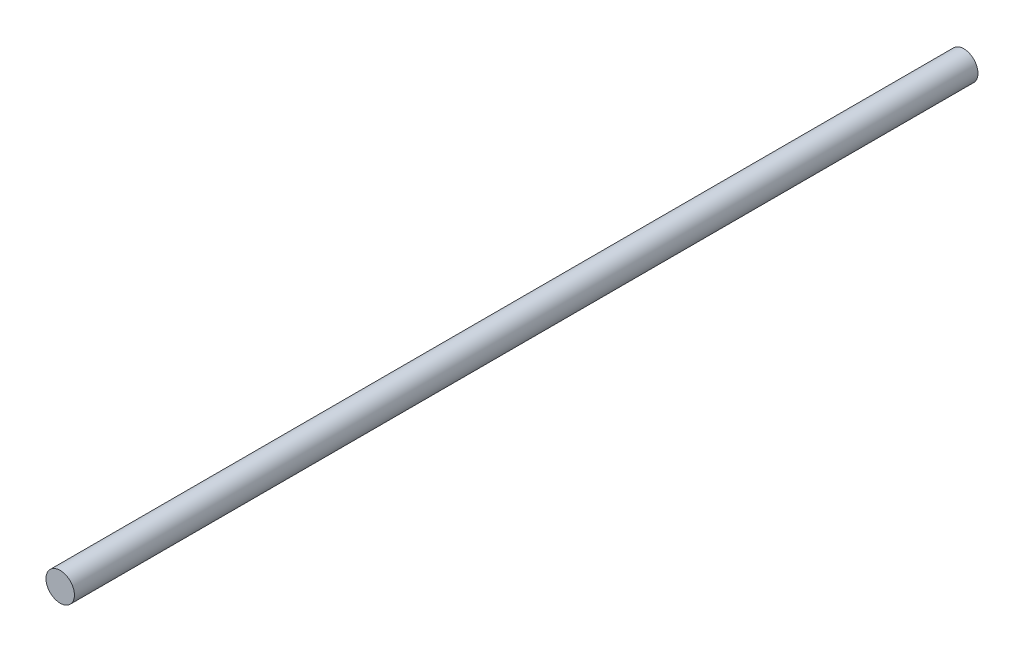
from build123d import *

# Parameters (mm, degrees)
SKETCH1_R           = 4
BOSS_EXTRUDE1_DEPTH = 254


with BuildPart() as part:
    # Sketch1 → Boss-Extrude1 (new body)
    with BuildSketch(Plane.XY):
        Circle(SKETCH1_R)
    extrude(amount=BOSS_EXTRUDE1_DEPTH)


solid = part.part
